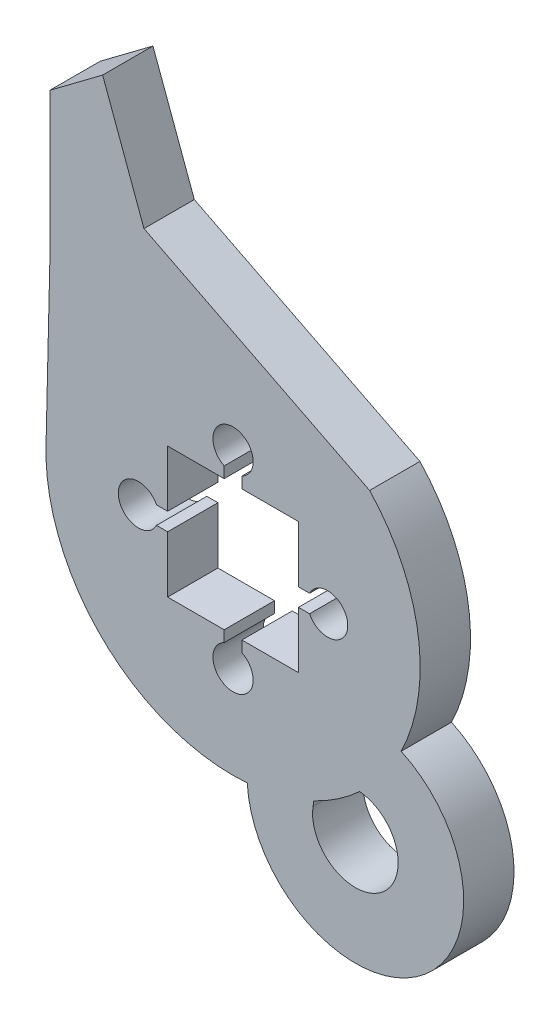
from build123d import *

# Parameters (mm, degrees)
BOSS_EXTRUDE1_DEPTH = 6.35
BOSS_EXTRUDE3_DEPTH = 6.35


with BuildPart() as part:
    # Sketch1 → Boss-Extrude1 (new body)
    with BuildSketch(Plane.XY):
        with BuildLine():
            Line((-23.080739782, 22.623363343), (-23.587362778, 1.111628824))
            ThreePointArc((-23.587362778, 1.111628824), (8.159769108, -22.158916254), (17.23339163, 16.143407769))
            Line((17.23339163, 16.143407769), (-11.238980923, 30.520917168))
            Line((-11.238980923, 30.520917168), (-16.457039411, 44.691234922))
            Line((-16.457039411, 44.691234922), (-23.120633834, 39.693776399))
            Line((-23.120633834, 39.693776399), (-23.080739782, 22.623363343))
        make_face()
        with BuildLine():
            ThreePointArc((1.1176, 9.657085657), (0, 14.478), (-1.1176, 9.657085657))
            Line((-1.1176, 9.657085657), (-1.1176, 8.255))
            Line((-1.1176, 8.255), (-8.255, 8.255))
            Line((-8.255, 8.255), (-8.255, 1.1176))
            Line((-8.255, 1.1176), (-9.657085657, 1.1176))
            ThreePointArc((-9.657085657, 1.1176), (-14.478, 0), (-9.657085657, -1.1176))
            Line((-9.657085657, -1.1176), (-8.255, -1.1176))
            Line((-8.255, -1.1176), (-8.255, -8.255))
            Line((-8.255, -8.255), (-1.1176, -8.255))
            Line((-1.1176, -8.255), (-1.1176, -9.657085657))
            ThreePointArc((-1.1176, -9.657085657), (0, -14.478), (1.1176, -9.657085657))
            Line((1.1176, -9.657085657), (1.1176, -8.255))
            Line((1.1176, -8.255), (8.255, -8.255))
            Line((8.255, -8.255), (8.255, -1.1176))
            Line((8.255, -1.1176), (9.657085657, -1.1176))
            ThreePointArc((9.657085657, -1.1176), (14.478, 0), (9.657085657, 1.1176))
            Line((9.657085657, 1.1176), (8.255, 1.1176))
            Line((8.255, 1.1176), (8.255, 8.255))
            Line((8.255, 8.255), (1.1176, 8.255))
            Line((1.1176, 8.255), (1.1176, 9.657085657))
        make_face(mode=Mode.SUBTRACT)
    extrude(amount=BOSS_EXTRUDE1_DEPTH)

    # Sketch2 → Boss-Extrude3 (add)
    with BuildSketch(Plane(origin=(0, 0, 0), x_dir=(-1, 0, 0), z_dir=(0, 0, -1))):
        with BuildLine():
            ThreePointArc((-13.902877587, -9.175702687), (-24.867617177, -32.651605631), (-1.941453441, -20.57954907))
            ThreePointArc((-1.941453441, -20.57954907), (-6.682478708, -17.156714595), (-10.105313182, -21.897739863))
            ThreePointArc((-10.105313182, -21.897739863), (-19.161295375, -26.666279881), (-14.830152685, -17.393147165))
            ThreePointArc((-14.830152685, -17.393147165), (-10.257792897, -13.748062475), (-13.902877587, -9.175702687))
        make_face()
    extrude(amount=-BOSS_EXTRUDE3_DEPTH)


solid = part.part
